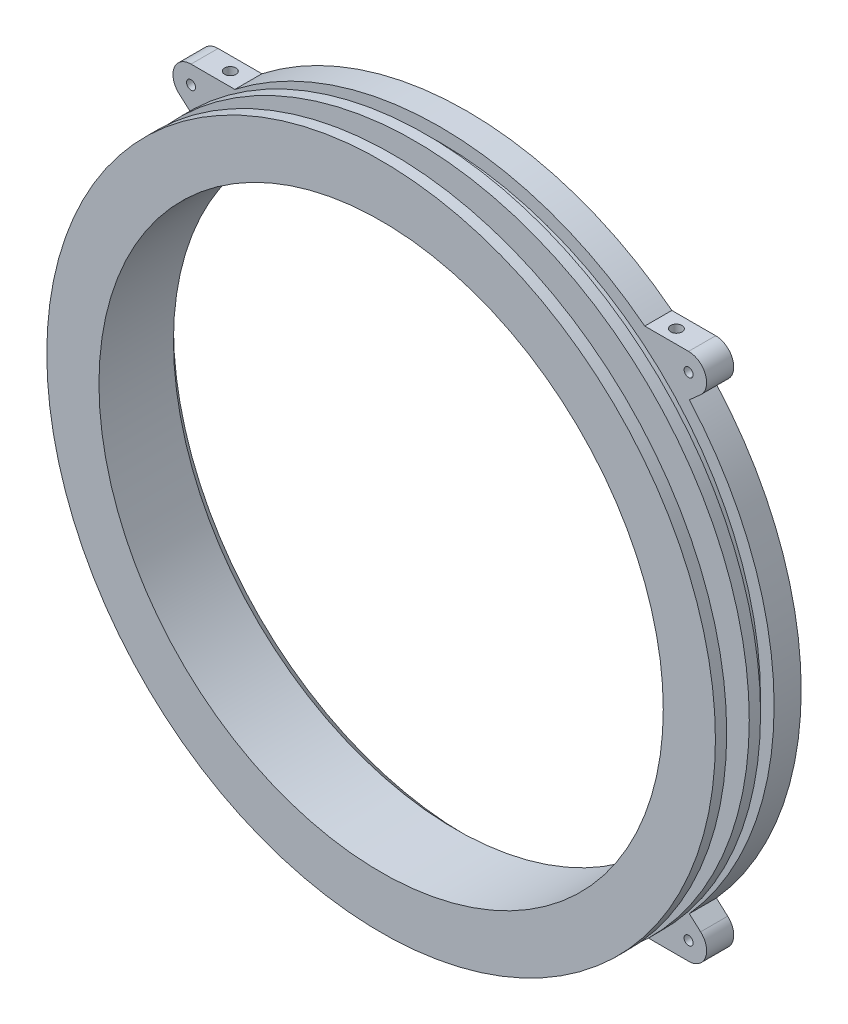
from build123d import *

# Parameters (mm, degrees)
SKETCH_1_R               = 148.1
SKETCH_1_R_2             = 125
EXTRUDE_1_DEPTH          = 12
SKETCH_2_R               = 142.1
SKETCH_2_R_2             = 125
EXTRUDE_2_DEPTH          = 6
SKETCH_3_R               = 148.1
SKETCH_3_R_2             = 125
EXTRUDE_3_DEPTH          = 5
SKETCH_4_R               = 133.1
SKETCH_4_R_2             = 125
EXTRUDE_4_DEPTH          = 10
SKETCH_5_R               = 148.1
SKETCH_5_R_2             = 125
EXTRUDE_5_DEPTH          = 5
SKETCH_6_R               = 2
EXTRUDE_6_DEPTH          = 12
SKETCH_7_R               = 2.5
CUT_EXTRUDE_1_DEPTH      = 15
MIRROR_2_COPY_1_SKETCH_R = 2.5
MIRROR_2_COPY_1_DEPTH    = 15
CHAMFER_1_SIZE           = 5


with BuildPart() as part:
    # 草图1 → 凸台-拉伸1 (new body)
    with BuildSketch(Plane.XY):
        Circle(SKETCH_1_R)
        Circle(SKETCH_1_R_2, mode=Mode.SUBTRACT)
    extrude(amount=EXTRUDE_1_DEPTH)

    # 草图2 → 凸台-拉伸2 (add)
    with BuildSketch(Plane.XY.offset(12)):
        Circle(SKETCH_2_R)
        Circle(SKETCH_2_R_2, mode=Mode.SUBTRACT)
    extrude(amount=EXTRUDE_2_DEPTH)

    # 草图3 → 凸台-拉伸3 (add)
    with BuildSketch(Plane.XY.offset(18)):
        Circle(SKETCH_3_R)
        Circle(SKETCH_3_R_2, mode=Mode.SUBTRACT)
    extrude(amount=EXTRUDE_3_DEPTH)

    # 草图4 → 凸台-拉伸4 (add)
    with BuildSketch(Plane.XY.offset(23)):
        Circle(SKETCH_4_R)
        Circle(SKETCH_4_R_2, mode=Mode.SUBTRACT)
    extrude(amount=EXTRUDE_4_DEPTH)

    # 草图5 → 凸台-拉伸5 (add)
    with BuildSketch(Plane.XY.offset(33)):
        Circle(SKETCH_5_R)
        Circle(SKETCH_5_R_2, mode=Mode.SUBTRACT)
    extrude(amount=EXTRUDE_5_DEPTH)

    # 草图6 → 凸台-拉伸6 (add)
    # profile 1 of 4: a face of its own
    with BuildSketch(Plane.XY):
        with BuildLine():
            Line((-90.799834802, 117), (-110.208193805, 117))
            ThreePointArc((-110.208193805, 117), (-117.683675787, 111.849064607), (-115.532726589, 103.029292284))
            Line((-115.532726589, 103.029292284), (-110.532726589, 98.570413171))
            ThreePointArc((-110.532726589, 98.570413171), (-101.087152926, 108.235842092), (-90.799834802, 117))
        make_face()
        with Locations((-110.208193805, 109)):
            Circle(SKETCH_6_R, mode=Mode.SUBTRACT)
    # profile 2 of 4: a face of its own
    with BuildSketch(Plane.XY):
        with BuildLine():
            Line((115.532726589, 103.029292284), (110.532726589, 98.570413171))
            ThreePointArc((110.532726589, 98.570413171), (101.087152926, 108.235842092), (90.799834802, 117))
            Line((90.799834802, 117), (110.208193805, 117))
            ThreePointArc((110.208193805, 117), (117.683675787, 111.849064607), (115.532726589, 103.029292284))
        make_face()
        with Locations(Location((110.208193805, 109, 0), (0, 0, 180))):
            Circle(SKETCH_6_R, mode=Mode.SUBTRACT)
    # profile 3 of 4: a face of its own
    with BuildSketch(Plane.XY):
        with BuildLine():
            Line((115.532726589, -103.029292284), (110.532726589, -98.570413171))
            ThreePointArc((110.532726589, -98.570413171), (101.087152926, -108.235842092), (90.799834802, -117))
            Line((90.799834802, -117), (110.208193805, -117))
            ThreePointArc((110.208193805, -117), (117.683675787, -111.849064607), (115.532726589, -103.029292284))
        make_face()
        with Locations((110.208193805, -109)):
            Circle(SKETCH_6_R, mode=Mode.SUBTRACT)
    # profile 4 of 4: a face of its own
    with BuildSketch(Plane.XY):
        with BuildLine():
            Line((-115.532726589, -103.029292284), (-110.532726589, -98.570413171))
            ThreePointArc((-110.532726589, -98.570413171), (-101.087152926, -108.235842092), (-90.799834802, -117))
            Line((-90.799834802, -117), (-110.208193805, -117))
            ThreePointArc((-110.208193805, -117), (-117.683675787, -111.849064607), (-115.532726589, -103.029292284))
        make_face()
        with Locations(Location((-110.208193805, -109, 0), (0, 0, 180))):
            Circle(SKETCH_6_R, mode=Mode.SUBTRACT)
    extrude(amount=EXTRUDE_6_DEPTH)

    # 草图7 → 切除-拉伸1 (cut)
    with BuildSketch(Plane(origin=(0, 117, 0), x_dir=(1, 0, 0), z_dir=(0, 1, 0))):
        with Locations(Location((-98.799834802, -6, 0), (0, 0, 270))):
            Circle(SKETCH_7_R)
    cut_extrude_1 = extrude(amount=-CUT_EXTRUDE_1_DEPTH, mode=Mode.SUBTRACT)

    # 镜向1: 切除-拉伸1 across plane
    add(cut_extrude_1.mirror(Plane(origin=(0, 0, 0), x_dir=(0, 0, 1), z_dir=(1, 0, 0))), mode=Mode.SUBTRACT)

    # 镜向2: 切除-拉伸1 across plane
    add(cut_extrude_1.mirror(Plane.ZX), mode=Mode.SUBTRACT)

    # 镜向2 copy 1 sketch → 镜向2 copy 1 (cut)
    with BuildSketch(Plane(origin=(0, -117, 0), x_dir=(-1, 0, 0), z_dir=(0, -1, 0))):
        with Locations(Location((-98.799834802, -6, 0), (0, 0, 270))):
            Circle(MIRROR_2_COPY_1_SKETCH_R)
    extrude(amount=-MIRROR_2_COPY_1_DEPTH, mode=Mode.SUBTRACT)

    # 倒角1
    chamfer_1_edges = [part.edges().sort_by_distance(p)[0] for p in [
        (-125, 0, 0),
    ]]
    chamfer(chamfer_1_edges, length=CHAMFER_1_SIZE)


solid = part.part
